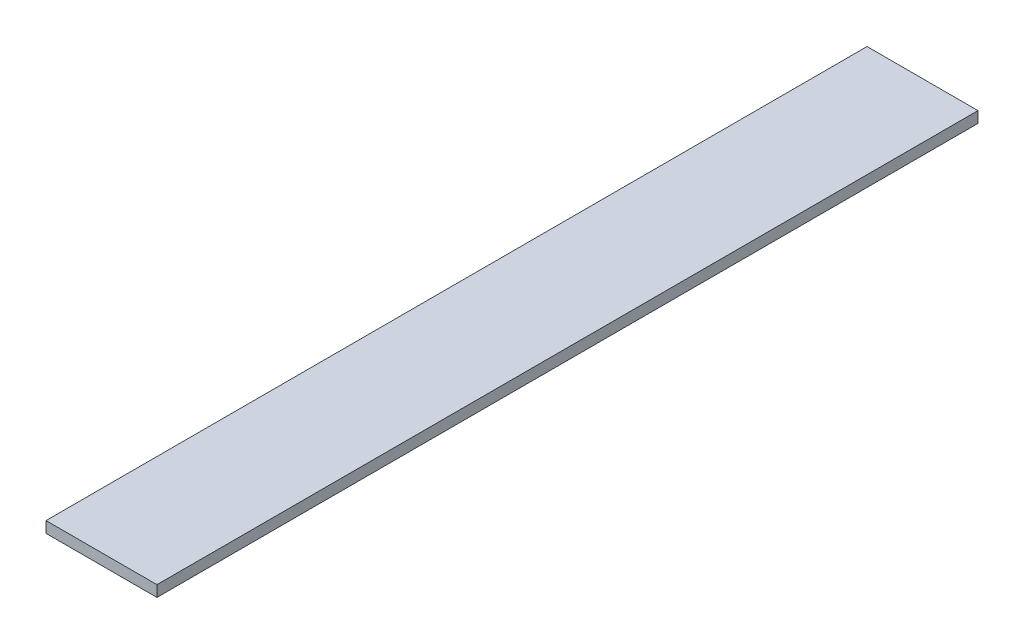
from build123d import *

# Parameters (mm, degrees)
SKETCH1_W           = 63.5
SKETCH1_H           = 469.9
BOSS_EXTRUDE1_DEPTH = 6.35


with BuildPart() as part:
    # Sketch1 → Boss-Extrude1 (new body)
    with BuildSketch(Plane(origin=(0, 0, 0), x_dir=(1, 0, 0), z_dir=(0, 1, 0))):
        with Locations((31.75, 234.95)):
            Rectangle(SKETCH1_W, SKETCH1_H)
    extrude(amount=BOSS_EXTRUDE1_DEPTH)


solid = part.part
